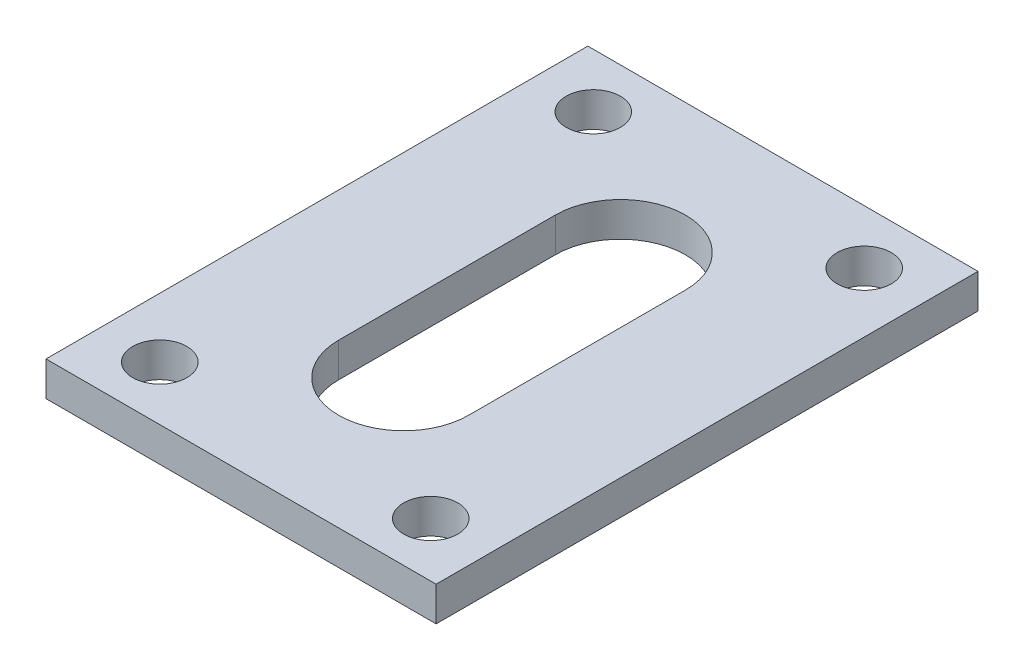
from build123d import *

# Parameters (mm, degrees)
SKETCH1_W           = 36
SKETCH1_H           = 50
BOSS_EXTRUDE1_DEPTH = 3.175
CUT_EXTRUDE1_REACH  = 32.969
SKETCH3_R           = 2.5
CUT_EXTRUDE2_REACH  = 32.969


with BuildPart() as part:
    # Sketch1 → Boss-Extrude1 (new body)
    with BuildSketch(Plane(origin=(0, 0, 0), x_dir=(1, 0, 0), z_dir=(0, 1, 0))):
        Rectangle(SKETCH1_W, SKETCH1_H)
    extrude(amount=BOSS_EXTRUDE1_DEPTH)

    # Sketch3 → Cut-Extrude1 (cut, up to next)
    with BuildSketch(Plane(origin=(0, 3.175, 0), x_dir=(1, 0, 0), z_dir=(0, 1, 0)), mode=Mode.PRIVATE) as cut_extrude1_sk1:
        with Locations(Location((-12.5, 20, 0), (0, 0, 270))):
            Circle(SKETCH3_R)
    cut_extrude1_tool1 = extrude(cut_extrude1_sk1.sketch, amount=-CUT_EXTRUDE1_REACH, mode=Mode.PRIVATE) & part.part
    # Sketch3 → Cut-Extrude1 (cut, up to next)
    with BuildSketch(Plane(origin=(0, 3.175, 0), x_dir=(1, 0, 0), z_dir=(0, 1, 0)), mode=Mode.PRIVATE) as cut_extrude1_sk2:
        with Locations(Location((12.5, 20, 0), (0, 0, 270))):
            Circle(SKETCH3_R)
    cut_extrude1_tool2 = extrude(cut_extrude1_sk2.sketch, amount=-CUT_EXTRUDE1_REACH, mode=Mode.PRIVATE) & part.part
    # Sketch3 → Cut-Extrude1 (cut, up to next)
    with BuildSketch(Plane(origin=(0, 3.175, 0), x_dir=(1, 0, 0), z_dir=(0, 1, 0)), mode=Mode.PRIVATE) as cut_extrude1_sk3:
        with Locations(Location((12.5, -20, 0), (0, 0, 270))):
            Circle(SKETCH3_R)
    cut_extrude1_tool3 = extrude(cut_extrude1_sk3.sketch, amount=-CUT_EXTRUDE1_REACH, mode=Mode.PRIVATE) & part.part
    # Sketch3 → Cut-Extrude1 (cut, up to next)
    with BuildSketch(Plane(origin=(0, 3.175, 0), x_dir=(1, 0, 0), z_dir=(0, 1, 0)), mode=Mode.PRIVATE) as cut_extrude1_sk4:
        with Locations(Location((-12.5, -20, 0), (0, 0, 270))):
            Circle(SKETCH3_R)
    cut_extrude1_tool4 = extrude(cut_extrude1_sk4.sketch, amount=-CUT_EXTRUDE1_REACH, mode=Mode.PRIVATE) & part.part
    add(cut_extrude1_tool1.solids().sort_by_distance((-12.5, 3.175, -20))[0], mode=Mode.SUBTRACT)
    add(cut_extrude1_tool2.solids().sort_by_distance((12.5, 3.175, -20))[0], mode=Mode.SUBTRACT)
    add(cut_extrude1_tool3.solids().sort_by_distance((12.5, 3.175, 20))[0], mode=Mode.SUBTRACT)
    add(cut_extrude1_tool4.solids().sort_by_distance((-12.5, 3.175, 20))[0], mode=Mode.SUBTRACT)

    # Sketch4 → Cut-Extrude2 (cut, up to next)
    with BuildSketch(Plane(origin=(0, 3.175, 0), x_dir=(1, 0, 0), z_dir=(0, 1, 0)), mode=Mode.PRIVATE) as cut_extrude2_sk1:
        with BuildLine():
            Line((-6, -10), (-6, 10))
            ThreePointArc((-6, 10), (0, 16), (6, 10))
            Line((6, 10), (6, -10))
            ThreePointArc((6, -10), (0, -16), (-6, -10))
        make_face()
    cut_extrude2_tool1 = extrude(cut_extrude2_sk1.sketch, amount=-CUT_EXTRUDE2_REACH, mode=Mode.PRIVATE) & part.part
    add(cut_extrude2_tool1.solids().sort_by_distance((0, 3.175, 0))[0], mode=Mode.SUBTRACT)


solid = part.part
